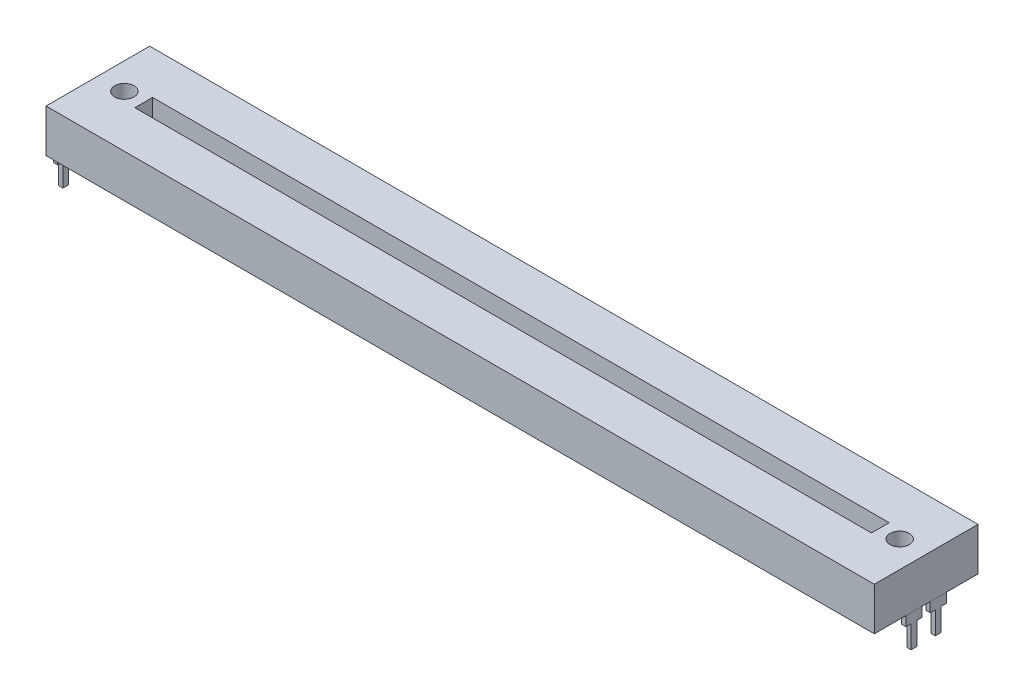
from build123d import *

# Parameters (mm, degrees)
SKETCH1_W           = 128.2
SKETCH1_H           = 16.05
BOSS_EXTRUDE1_DEPTH = 6.65
SKETCH2_R           = 1.5
SKETCH2_W           = 114
SKETCH2_H           = 2.75
CUT_EXTRUDE1_DEPTH  = 4
BOSS_EXTRUDE2_DEPTH = 0.65
BOSS_EXTRUDE3_DEPTH = 0.65


with BuildPart() as part:
    # Sketch1 → Boss-Extrude1 (new body)
    with BuildSketch(Plane(origin=(0, 0, 0), x_dir=(1, 0, 0), z_dir=(0, 1, 0))):
        Rectangle(SKETCH1_W, SKETCH1_H)
    extrude(amount=-BOSS_EXTRUDE1_DEPTH)

    # Sketch2 → Cut-Extrude1 (cut)
    with BuildSketch(Plane(origin=(0, 0, 0), x_dir=(1, 0, 0), z_dir=(0, 1, 0))):
        with Locations(Location((-60, 0, 0), (0, 0, 270))):
            Circle(SKETCH2_R)
        with Locations(Location((60, 0, 0), (0, 0, 90))):
            Circle(SKETCH2_R)
        Rectangle(SKETCH2_W, SKETCH2_H)
    extrude(amount=-CUT_EXTRUDE1_DEPTH, mode=Mode.SUBTRACT)

    # Sketch3 → Boss-Extrude2 (add)
    with BuildSketch(Plane.ZY.offset(64.09)):
        Polygon((-6.875, -6.65), (-6.875, -8.15), (-6.075, -8.15), (-6.075, -11.65), (-5.175, -11.65), (-5.175, -8.15), (-4.375, -8.15), (-4.375, -6.65), align=None)
        Polygon((-0.625, -6.65), (-3.125, -6.65), (-3.125, -8.15), (-2.325, -8.15), (-2.325, -11.65), (-1.425, -11.65), (-1.425, -8.15), (-0.625, -8.15), align=None)
        Polygon((3.125, -6.65), (0.625, -6.65), (0.625, -8.15), (1.425, -8.15), (1.425, -11.65), (2.325, -11.65), (2.325, -8.15), (3.125, -8.15), align=None)
        Polygon((6.875, -6.65), (4.375, -6.65), (4.375, -8.15), (5.175, -8.15), (5.175, -11.65), (6.075, -11.65), (6.075, -8.15), (6.875, -8.15), align=None)
    extrude(amount=-BOSS_EXTRUDE2_DEPTH)

    # Sketch4 → Boss-Extrude3 (add)
    with BuildSketch(Plane(origin=(64.09, 0, 0), x_dir=(0, 0, -1), z_dir=(1, 0, 0))):
        Polygon((-0.625, -8.15), (-0.625, -6.65), (-3.125, -6.65), (-3.125, -8.15), (-2.325, -8.15), (-2.325, -11.65), (-1.425, -11.65), (-1.425, -8.15), align=None)
        Polygon((3.125, -8.15), (3.125, -6.65), (0.625, -6.65), (0.625, -8.15), (1.425, -8.15), (1.425, -11.65), (2.325, -11.65), (2.325, -8.15), align=None)
    extrude(amount=-BOSS_EXTRUDE3_DEPTH)


solid = part.part
